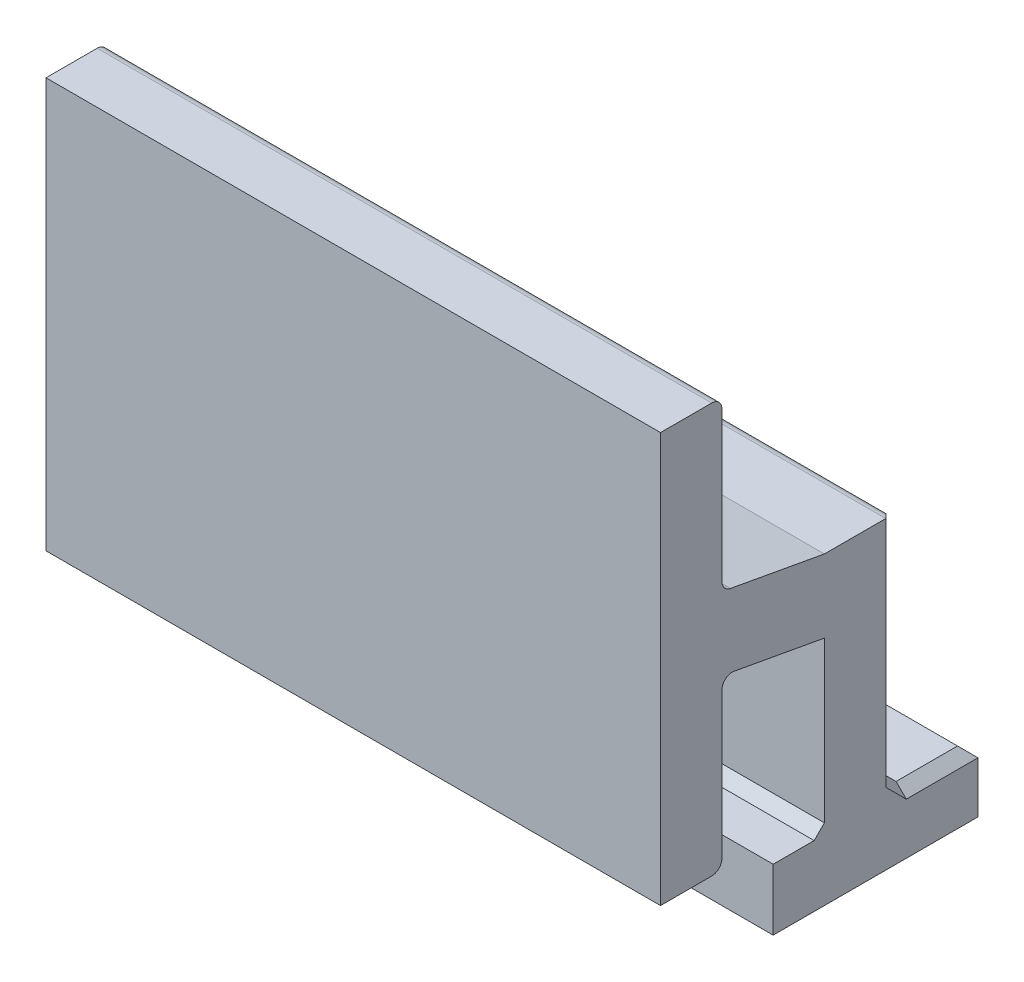
from build123d import *

# Parameters (mm, degrees)
BOSS_EXTRUDE1_DEPTH = 30
CHAMFER1_SIZE       = 0.5
FILLET1_R           = 0.5


with BuildPart() as part:
    # Sketch1 → Boss-Extrude1 (new body)
    with BuildSketch(Plane(origin=(0, 0, 0), x_dir=(0, 0, -1), z_dir=(1, 0, 0))):
        Polygon((-5, 0), (-5, 3), (-2.5, 3), (-2.5, 11.309733412), (-7.5, 12.221162959), (-7.5, 4), (-10.5, 4), (-10.5, 24), (-7.5, 24), (-7.5, 15.778837041), (-2.5, 14.867407493), (1, 14.867407493), (1, 3), (5, 3), (5, 0), align=None)
    extrude(amount=BOSS_EXTRUDE1_DEPTH)

    # Chamfer1
    chamfer1_edges = [part.edges().sort_by_distance(p)[0] for p in [
        (15, 3, 2.5),
        (0, 3, -3),
        (30, 8.933703747, -1),
        (0, 8.933703747, -1),
        (15, 3, -5),
        (30, 3, -3),
        (15, 3, -1),
    ]]
    chamfer(chamfer1_edges, length=CHAMFER1_SIZE)

    # Fillet1
    fillet1_edges = [part.edges().sort_by_distance(p)[0] for p in [
        (15, 4, 7.5),
        (15, 24, 7.5),
        (15, 12.221162959, 7.5),
        (15, 15.778837041, 7.5),
        (15, 14.867407493, -1),
    ]]
    fillet(fillet1_edges, radius=FILLET1_R)


solid = part.part
